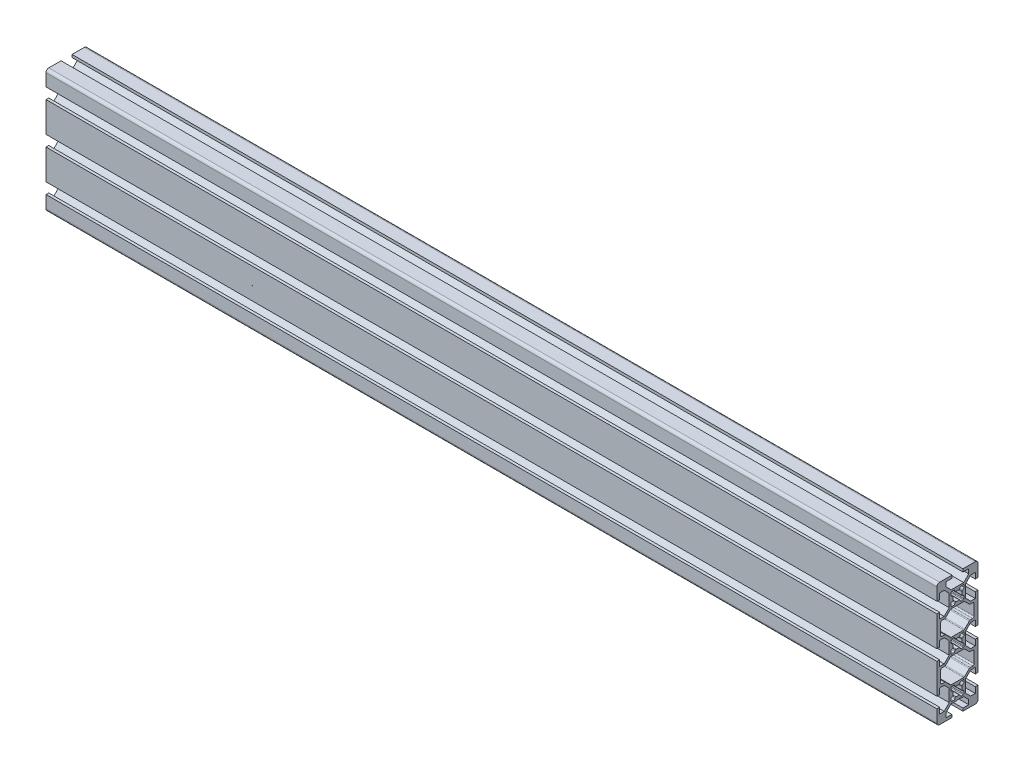
from build123d import *

# Parameters (mm, degrees)
BOSS_EXTRUDE1_DEPTH = 650


with BuildPart() as part:
    # Sketch1 → Boss-Extrude1 (new body)
    with BuildSketch(Plane(origin=(0, 0, 0), x_dir=(0, 0, -1), z_dir=(1, 0, 0))):
        with BuildLine():
            Line((-15, -34), (-15, -43))
            ThreePointArc((-15, -43), (-14.414213562, -44.414213562), (-13, -45))
            Line((-13, -45), (-4, -45))
            Line((-4, -45), (-4, -43))
            Line((-4, -43), (-8.25, -43))
            Line((-8.25, -43), (-8.25, -39.664213562))
            Line((-8.25, -39.664213562), (-4.585786438, -36))
            Line((-4.585786438, -36), (-0.653589838, -36))
            ThreePointArc((-0.653589838, -36), (-0.524180316, -35.982962913), (-0.403589838, -35.933012702))
            Line((-0.403589838, -35.933012702), (0, -35.7))
            Line((0, -35.7), (0.403589838, -35.933012702))
            ThreePointArc((0.403589838, -35.933012702), (0.653589838, -36), (0.903589838, -35.933012702))
            Line((0.903589838, -35.933012702), (1.218885629, -35.750976592))
            Line((1.218885629, -35.750976592), (2.5, -36))
            Line((2.5, -36), (4.585786438, -36))
            Line((4.585786438, -36), (8.25, -39.664213562))
            Line((8.25, -39.664213562), (8.25, -43))
            Line((8.25, -43), (4, -43))
            Line((4, -43), (4, -45))
            Line((4, -45), (13, -45))
            ThreePointArc((13, -45), (14.414213562, -44.414213562), (15, -43))
            Line((15, -43), (15, -34))
            Line((15, -34), (13, -34))
            Line((13, -34), (13, -38.25))
            Line((13, -38.25), (9.664213562, -38.25))
            Line((9.664213562, -38.25), (6, -34.585786438))
            Line((6, -34.585786438), (6, -25.414213562))
            Line((6, -25.414213562), (9.664213562, -21.75))
            Line((9.664213562, -21.75), (13, -21.75))
            Line((13, -21.75), (13, -26))
            Line((13, -26), (15, -26))
            Line((15, -26), (15, -4))
            Line((15, -4), (13, -4))
            Line((13, -4), (13, -8.25))
            Line((13, -8.25), (9.664213562, -8.25))
            Line((9.664213562, -8.25), (6, -4.585786438))
            Line((6, -4.585786438), (6, 4.585786438))
            Line((6, 4.585786438), (9.664213562, 8.25))
            Line((9.664213562, 8.25), (13, 8.25))
            Line((13, 8.25), (13, 4))
            Line((13, 4), (15, 4))
            Line((15, 4), (15, 26))
            Line((15, 26), (13, 26))
            Line((13, 26), (13, 21.75))
            Line((13, 21.75), (9.664213562, 21.75))
            Line((9.664213562, 21.75), (6, 25.414213562))
            Line((6, 25.414213562), (6, 34.585786438))
            Line((6, 34.585786438), (9.664213562, 38.25))
            Line((9.664213562, 38.25), (13, 38.25))
            Line((13, 38.25), (13, 34))
            Line((13, 34), (15, 34))
            Line((15, 34), (15, 43))
            ThreePointArc((15, 43), (14.414213562, 44.414213562), (13, 45))
            Line((13, 45), (4, 45))
            Line((4, 45), (4, 43))
            Line((4, 43), (8.25, 43))
            Line((8.25, 43), (8.25, 39.664213562))
            Line((8.25, 39.664213562), (4.585786438, 36))
            Line((4.585786438, 36), (-4.585786438, 36))
            Line((-4.585786438, 36), (-8.25, 39.664213562))
            Line((-8.25, 39.664213562), (-8.25, 43))
            Line((-8.25, 43), (-4, 43))
            Line((-4, 43), (-4, 45))
            Line((-4, 45), (-13, 45))
            ThreePointArc((-13, 45), (-14.414213562, 44.414213562), (-15, 43))
            Line((-15, 43), (-15, 34))
            Line((-15, 34), (-13, 34))
            Line((-13, 34), (-13, 38.25))
            Line((-13, 38.25), (-9.664213562, 38.25))
            Line((-9.664213562, 38.25), (-6, 34.585786438))
            Line((-6, 34.585786438), (-6, 25.414213562))
            Line((-6, 25.414213562), (-9.664213562, 21.75))
            Line((-9.664213562, 21.75), (-13, 21.75))
            Line((-13, 21.75), (-13, 26))
            Line((-13, 26), (-15, 26))
            Line((-15, 26), (-15, 4))
            Line((-15, 4), (-13, 4))
            Line((-13, 4), (-13, 8.25))
            Line((-13, 8.25), (-9.664213562, 8.25))
            Line((-9.664213562, 8.25), (-6, 4.585786438))
            Line((-6, 4.585786438), (-6, -4.585786438))
            Line((-6, -4.585786438), (-9.664213562, -8.25))
            Line((-9.664213562, -8.25), (-13, -8.25))
            Line((-13, -8.25), (-13, -4))
            Line((-13, -4), (-15, -4))
            Line((-15, -4), (-15, -26))
            Line((-15, -26), (-13, -26))
            Line((-13, -26), (-13, -21.75))
            Line((-13, -21.75), (-9.664213562, -21.75))
            Line((-9.664213562, -21.75), (-6, -25.414213562))
            Line((-6, -25.414213562), (-6, -34.585786438))
            Line((-6, -34.585786438), (-9.664213562, -38.25))
            Line((-9.664213562, -38.25), (-13, -38.25))
            Line((-13, -38.25), (-13, -34))
            Line((-13, -34), (-15, -34))
        make_face()
        with BuildLine():
            Line((-9.367193001, 20.05), (-11.2, 20.05))
            ThreePointArc((-11.2, 20.05), (-11.907106781, 19.757106781), (-12.2, 19.05))
            Line((-12.2, 19.05), (-12.2, 10.95))
            ThreePointArc((-12.2, 10.95), (-11.907106781, 10.242893219), (-11.2, 9.95))
            Line((-11.2, 9.95), (-9.367193001, 9.95))
            ThreePointArc((-9.367193001, 9.95), (-8.984509569, 9.873879533), (-8.66008622, 9.657106781))
            Line((-8.66008622, 9.657106781), (-5.295872657, 6.292893219))
            ThreePointArc((-5.295872657, 6.292893219), (-4.971449309, 6.076120467), (-4.588765876, 6))
            Line((-4.588765876, 6), (4.595836944, 6))
            ThreePointArc((4.595836944, 6), (4.978520376, 6.076120467), (5.302943725, 6.292893219))
            Line((5.302943725, 6.292893219), (8.667157288, 9.657106781))
            ThreePointArc((8.667157288, 9.657106781), (8.991580636, 9.873879533), (9.374264069, 9.95))
            Line((9.374264069, 9.95), (11.2, 9.95))
            ThreePointArc((11.2, 9.95), (11.907106781, 10.242893219), (12.2, 10.95))
            Line((12.2, 10.95), (12.2, 19.05))
            ThreePointArc((12.2, 19.05), (11.907106781, 19.757106781), (11.2, 20.05))
            Line((11.2, 20.05), (9.374264069, 20.05))
            ThreePointArc((9.374264069, 20.05), (8.991580636, 20.126120467), (8.667157288, 20.342893219))
            Line((8.667157288, 20.342893219), (5.302943725, 23.707106781))
            ThreePointArc((5.302943725, 23.707106781), (4.978520376, 23.923879533), (4.595836944, 24))
            Line((4.595836944, 24), (-4.588765876, 24))
            ThreePointArc((-4.588765876, 24), (-4.971449309, 23.923879533), (-5.295872657, 23.707106781))
            Line((-5.295872657, 23.707106781), (-8.66008622, 20.342893219))
            ThreePointArc((-8.66008622, 20.342893219), (-8.984509569, 20.126120467), (-9.367193001, 20.05))
        make_face(mode=Mode.SUBTRACT)
        with BuildLine():
            Line((1.969039233, 34.222618262), (1.597027384, 33.424836278))
            ThreePointArc((1.597027384, 33.424836278), (1.390932719, 33.225739399), (1.104556452, 33.215580048))
            ThreePointArc((1.104556452, 33.215580048), (0, 33.4), (-1.104556452, 33.215580048))
            ThreePointArc((-1.104556452, 33.215580048), (-1.390932719, 33.225739399), (-1.597027384, 33.424836278))
            Line((-1.597027384, 33.424836278), (-1.969039233, 34.222618262))
            ThreePointArc((-1.969039233, 34.222618262), (-2.338047412, 34.643391446), (-2.87534702, 34.8))
            Line((-2.87534702, 34.8), (-4.3, 34.8))
            ThreePointArc((-4.3, 34.8), (-4.653553391, 34.653553391), (-4.8, 34.3))
            Line((-4.8, 34.3), (-4.8, 32.87534702))
            ThreePointArc((-4.8, 32.87534702), (-4.643391446, 32.338047412), (-4.222618262, 31.969039233))
            Line((-4.222618262, 31.969039233), (-3.424836278, 31.597027384))
            ThreePointArc((-3.424836278, 31.597027384), (-3.225739399, 31.390932719), (-3.215580048, 31.104556452))
            ThreePointArc((-3.215580048, 31.104556452), (-3.4, 30), (-3.215580048, 28.895443548))
            ThreePointArc((-3.215580048, 28.895443548), (-3.225739399, 28.609067281), (-3.424836278, 28.402972616))
            Line((-3.424836278, 28.402972616), (-4.222618262, 28.030960767))
            ThreePointArc((-4.222618262, 28.030960767), (-4.643391446, 27.661952588), (-4.8, 27.12465298))
            Line((-4.8, 27.12465298), (-4.8, 25.7))
            ThreePointArc((-4.8, 25.7), (-4.653553391, 25.346446609), (-4.3, 25.2))
            Line((-4.3, 25.2), (-2.87534702, 25.2))
            ThreePointArc((-2.87534702, 25.2), (-2.338047412, 25.356608554), (-1.969039233, 25.777381738))
            Line((-1.969039233, 25.777381738), (-1.597027384, 26.575163722))
            ThreePointArc((-1.597027384, 26.575163722), (-1.390932719, 26.774260601), (-1.104556452, 26.784419952))
            ThreePointArc((-1.104556452, 26.784419952), (0, 26.6), (1.104556452, 26.784419952))
            ThreePointArc((1.104556452, 26.784419952), (1.390932719, 26.774260601), (1.597027384, 26.575163722))
            Line((1.597027384, 26.575163722), (1.969039233, 25.777381738))
            ThreePointArc((1.969039233, 25.777381738), (2.338047412, 25.356608554), (2.87534702, 25.2))
            Line((2.87534702, 25.2), (4.3, 25.2))
            ThreePointArc((4.3, 25.2), (4.653553391, 25.346446609), (4.8, 25.7))
            Line((4.8, 25.7), (4.8, 27.12465298))
            ThreePointArc((4.8, 27.12465298), (4.643391446, 27.661952588), (4.222618262, 28.030960767))
            Line((4.222618262, 28.030960767), (3.424836278, 28.402972616))
            ThreePointArc((3.424836278, 28.402972616), (3.225739399, 28.609067281), (3.215580048, 28.895443548))
            ThreePointArc((3.215580048, 28.895443548), (3.4, 30), (3.215580048, 31.104556452))
            ThreePointArc((3.215580048, 31.104556452), (3.225739399, 31.390932719), (3.424836278, 31.597027384))
            Line((3.424836278, 31.597027384), (4.222618262, 31.969039233))
            ThreePointArc((4.222618262, 31.969039233), (4.643391446, 32.338047412), (4.8, 32.87534702))
            Line((4.8, 32.87534702), (4.8, 34.3))
            ThreePointArc((4.8, 34.3), (4.653553391, 34.653553391), (4.3, 34.8))
            Line((4.3, 34.8), (2.87534702, 34.8))
            ThreePointArc((2.87534702, 34.8), (2.338047412, 34.643391446), (1.969039233, 34.222618262))
        make_face(mode=Mode.SUBTRACT)
        with BuildLine():
            Line((4.3, 4.8), (2.87534702, 4.8))
            ThreePointArc((2.87534702, 4.8), (2.338047412, 4.643391446), (1.969039233, 4.222618262))
            Line((1.969039233, 4.222618262), (1.597027384, 3.424836278))
            ThreePointArc((1.597027384, 3.424836278), (1.390932719, 3.225739399), (1.104556452, 3.215580048))
            ThreePointArc((1.104556452, 3.215580048), (0, 3.4), (-1.104556452, 3.215580048))
            ThreePointArc((-1.104556452, 3.215580048), (-1.390932719, 3.225739399), (-1.597027384, 3.424836278))
            Line((-1.597027384, 3.424836278), (-1.969039233, 4.222618262))
            ThreePointArc((-1.969039233, 4.222618262), (-2.338047412, 4.643391446), (-2.87534702, 4.8))
            Line((-2.87534702, 4.8), (-4.3, 4.8))
            ThreePointArc((-4.3, 4.8), (-4.653553391, 4.653553391), (-4.8, 4.3))
            Line((-4.8, 4.3), (-4.8, 2.87534702))
            ThreePointArc((-4.8, 2.87534702), (-4.643391446, 2.338047412), (-4.222618262, 1.969039233))
            Line((-4.222618262, 1.969039233), (-3.424836278, 1.597027384))
            ThreePointArc((-3.424836278, 1.597027384), (-3.225739399, 1.390932719), (-3.215580048, 1.104556452))
            ThreePointArc((-3.215580048, 1.104556452), (-3.4, 0), (-3.215580048, -1.104556452))
            ThreePointArc((-3.215580048, -1.104556452), (-3.225739399, -1.390932719), (-3.424836278, -1.597027384))
            Line((-3.424836278, -1.597027384), (-4.222618262, -1.969039233))
            ThreePointArc((-4.222618262, -1.969039233), (-4.643391446, -2.338047412), (-4.8, -2.87534702))
            Line((-4.8, -2.87534702), (-4.8, -4.3))
            ThreePointArc((-4.8, -4.3), (-4.653553391, -4.653553391), (-4.3, -4.8))
            Line((-4.3, -4.8), (-2.87534702, -4.8))
            ThreePointArc((-2.87534702, -4.8), (-2.338047412, -4.643391446), (-1.969039233, -4.222618262))
            Line((-1.969039233, -4.222618262), (-1.597027384, -3.424836278))
            ThreePointArc((-1.597027384, -3.424836278), (-1.390932719, -3.225739399), (-1.104556452, -3.215580048))
            ThreePointArc((-1.104556452, -3.215580048), (0, -3.4), (1.104556452, -3.215580048))
            ThreePointArc((1.104556452, -3.215580048), (1.390932719, -3.225739399), (1.597027384, -3.424836278))
            Line((1.597027384, -3.424836278), (1.969039233, -4.222618262))
            ThreePointArc((1.969039233, -4.222618262), (2.338047412, -4.643391446), (2.87534702, -4.8))
            Line((2.87534702, -4.8), (4.3, -4.8))
            ThreePointArc((4.3, -4.8), (4.653553391, -4.653553391), (4.8, -4.3))
            Line((4.8, -4.3), (4.8, -2.87534702))
            ThreePointArc((4.8, -2.87534702), (4.643391446, -2.338047412), (4.222618262, -1.969039233))
            Line((4.222618262, -1.969039233), (3.424836278, -1.597027384))
            ThreePointArc((3.424836278, -1.597027384), (3.225739399, -1.390932719), (3.215580048, -1.104556452))
            ThreePointArc((3.215580048, -1.104556452), (3.4, 0), (3.215580048, 1.104556452))
            ThreePointArc((3.215580048, 1.104556452), (3.225739399, 1.390932719), (3.424836278, 1.597027384))
            Line((3.424836278, 1.597027384), (4.222618262, 1.969039233))
            ThreePointArc((4.222618262, 1.969039233), (4.643391446, 2.338047412), (4.8, 2.87534702))
            Line((4.8, 2.87534702), (4.8, 4.3))
            ThreePointArc((4.8, 4.3), (4.653553391, 4.653553391), (4.3, 4.8))
        make_face(mode=Mode.SUBTRACT)
        with BuildLine():
            Line((-4.222618262, -28.030960767), (-3.424836278, -28.402972616))
            ThreePointArc((-3.424836278, -28.402972616), (-3.225739399, -28.609067281), (-3.215580048, -28.895443548))
            ThreePointArc((-3.215580048, -28.895443548), (-3.4, -30), (-3.215580048, -31.104556452))
            ThreePointArc((-3.215580048, -31.104556452), (-3.225739399, -31.390932719), (-3.424836278, -31.597027384))
            Line((-3.424836278, -31.597027384), (-4.222618262, -31.969039233))
            ThreePointArc((-4.222618262, -31.969039233), (-4.643391446, -32.338047412), (-4.8, -32.87534702))
            Line((-4.8, -32.87534702), (-4.8, -34.3))
            ThreePointArc((-4.8, -34.3), (-4.653553391, -34.653553391), (-4.3, -34.8))
            Line((-4.3, -34.8), (-2.87534702, -34.8))
            ThreePointArc((-2.87534702, -34.8), (-2.338047412, -34.643391446), (-1.969039233, -34.222618262))
            Line((-1.969039233, -34.222618262), (-1.597027384, -33.424836278))
            ThreePointArc((-1.597027384, -33.424836278), (-1.390932719, -33.225739399), (-1.104556452, -33.215580048))
            ThreePointArc((-1.104556452, -33.215580048), (0, -33.4), (1.104556452, -33.215580048))
            ThreePointArc((1.104556452, -33.215580048), (1.390932719, -33.225739399), (1.597027384, -33.424836278))
            Line((1.597027384, -33.424836278), (1.969039233, -34.222618262))
            ThreePointArc((1.969039233, -34.222618262), (2.338047412, -34.643391446), (2.87534702, -34.8))
            Line((2.87534702, -34.8), (4.3, -34.8))
            ThreePointArc((4.3, -34.8), (4.653553391, -34.653553391), (4.8, -34.3))
            Line((4.8, -34.3), (4.8, -32.87534702))
            ThreePointArc((4.8, -32.87534702), (4.643391446, -32.338047412), (4.222618262, -31.969039233))
            Line((4.222618262, -31.969039233), (3.424836278, -31.597027384))
            ThreePointArc((3.424836278, -31.597027384), (3.225739399, -31.390932719), (3.215580048, -31.104556452))
            ThreePointArc((3.215580048, -31.104556452), (3.4, -30), (3.215580048, -28.895443548))
            ThreePointArc((3.215580048, -28.895443548), (3.225739399, -28.609067281), (3.424836278, -28.402972616))
            Line((3.424836278, -28.402972616), (4.222618262, -28.030960767))
            ThreePointArc((4.222618262, -28.030960767), (4.643391446, -27.661952588), (4.8, -27.12465298))
            Line((4.8, -27.12465298), (4.8, -25.7))
            ThreePointArc((4.8, -25.7), (4.653553391, -25.346446609), (4.3, -25.2))
            Line((4.3, -25.2), (2.87534702, -25.2))
            ThreePointArc((2.87534702, -25.2), (2.338047412, -25.356608554), (1.969039233, -25.777381738))
            Line((1.969039233, -25.777381738), (1.597027384, -26.575163722))
            ThreePointArc((1.597027384, -26.575163722), (1.390932719, -26.774260601), (1.104556452, -26.784419952))
            ThreePointArc((1.104556452, -26.784419952), (0, -26.6), (-1.104556452, -26.784419952))
            ThreePointArc((-1.104556452, -26.784419952), (-1.390932719, -26.774260601), (-1.597027384, -26.575163722))
            Line((-1.597027384, -26.575163722), (-1.969039233, -25.777381738))
            ThreePointArc((-1.969039233, -25.777381738), (-2.338047412, -25.356608554), (-2.87534702, -25.2))
            Line((-2.87534702, -25.2), (-4.3, -25.2))
            ThreePointArc((-4.3, -25.2), (-4.653553391, -25.346446609), (-4.8, -25.7))
            Line((-4.8, -25.7), (-4.8, -27.12465298))
            ThreePointArc((-4.8, -27.12465298), (-4.643391446, -27.661952588), (-4.222618262, -28.030960767))
        make_face(mode=Mode.SUBTRACT)
        with BuildLine():
            Line((-9.367193001, -9.95), (-11.2, -9.95))
            ThreePointArc((-11.2, -9.95), (-11.907106781, -10.242893219), (-12.2, -10.95))
            Line((-12.2, -10.95), (-12.2, -19.05))
            ThreePointArc((-12.2, -19.05), (-11.907106781, -19.757106781), (-11.2, -20.05))
            Line((-11.2, -20.05), (-9.367193001, -20.05))
            ThreePointArc((-9.367193001, -20.05), (-8.984509569, -20.126120467), (-8.66008622, -20.342893219))
            Line((-8.66008622, -20.342893219), (-5.295872657, -23.707106781))
            ThreePointArc((-5.295872657, -23.707106781), (-4.971449309, -23.923879533), (-4.588765876, -24))
            Line((-4.588765876, -24), (4.595836944, -24))
            ThreePointArc((4.595836944, -24), (4.978520376, -23.923879533), (5.302943725, -23.707106781))
            Line((5.302943725, -23.707106781), (8.667157288, -20.342893219))
            ThreePointArc((8.667157288, -20.342893219), (8.991580636, -20.126120467), (9.374264069, -20.05))
            Line((9.374264069, -20.05), (11.2, -20.05))
            ThreePointArc((11.2, -20.05), (11.907106781, -19.757106781), (12.2, -19.05))
            Line((12.2, -19.05), (12.2, -10.95))
            ThreePointArc((12.2, -10.95), (11.907106781, -10.242893219), (11.2, -9.95))
            Line((11.2, -9.95), (9.374264069, -9.95))
            ThreePointArc((9.374264069, -9.95), (8.991580636, -9.873879533), (8.667157288, -9.657106781))
            Line((8.667157288, -9.657106781), (5.302943725, -6.292893219))
            ThreePointArc((5.302943725, -6.292893219), (4.978520376, -6.076120467), (4.595836944, -6))
            Line((4.595836944, -6), (-4.588765876, -6))
            ThreePointArc((-4.588765876, -6), (-4.971449309, -6.076120467), (-5.295872657, -6.292893219))
            Line((-5.295872657, -6.292893219), (-8.66008622, -9.657106781))
            ThreePointArc((-8.66008622, -9.657106781), (-8.984509569, -9.873879533), (-9.367193001, -9.95))
        make_face(mode=Mode.SUBTRACT)
    extrude(amount=BOSS_EXTRUDE1_DEPTH)


solid = part.part
